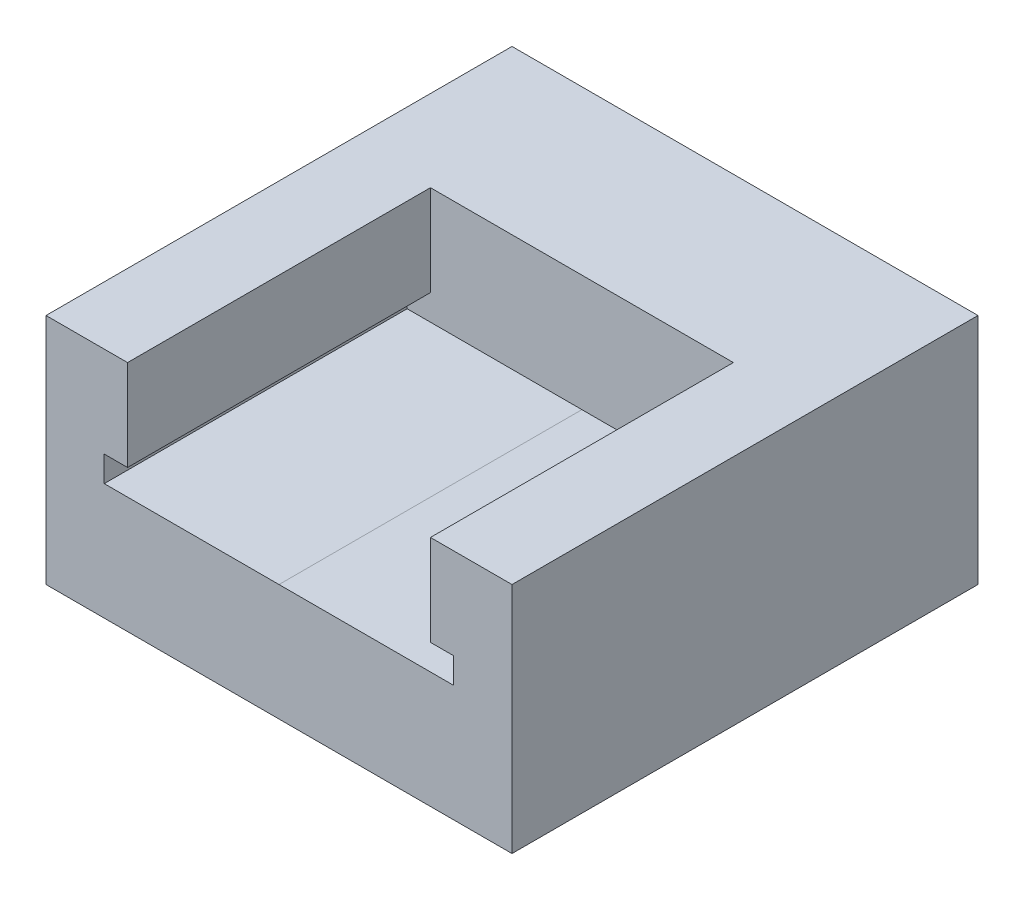
from build123d import *

# Parameters (mm, degrees)
SKETCH1_W               = 20
SKETCH1_H               = 10
BOSS_EXTRUDE1_DEPTH     = 20
CUT_EXTRUDE1_DEPTH      = 23.912878475
CUT_EXTRUDE1_DEPTH_BACK = 13


with BuildPart() as part:
    # Sketch1 → Boss-Extrude1 (new body)
    with BuildSketch(Plane.XY):
        Rectangle(SKETCH1_W, SKETCH1_H)
    extrude(amount=BOSS_EXTRUDE1_DEPTH)

    # Sketch2 → Cut-Extrude1 (cut, two sides: drawn at the far end of the back side and taken through both)
    with BuildSketch(Plane.XY.offset(20).offset(-CUT_EXTRUDE1_DEPTH_BACK)):
        Polygon((-6.5, 53.587562763), (-6.5, 5), (-6.5, 1.1), (-7.5, 1.1), (-7.5, 0), (0, 0), (7.5, 0), (7.5, 1.1), (6.5, 1.1), (6.5, 5), (6.5, 53.587562763), (6.5, 150.762688289), (-6.5, 150.762688289), align=None)
    extrude(amount=CUT_EXTRUDE1_DEPTH + CUT_EXTRUDE1_DEPTH_BACK, mode=Mode.SUBTRACT)


solid = part.part
